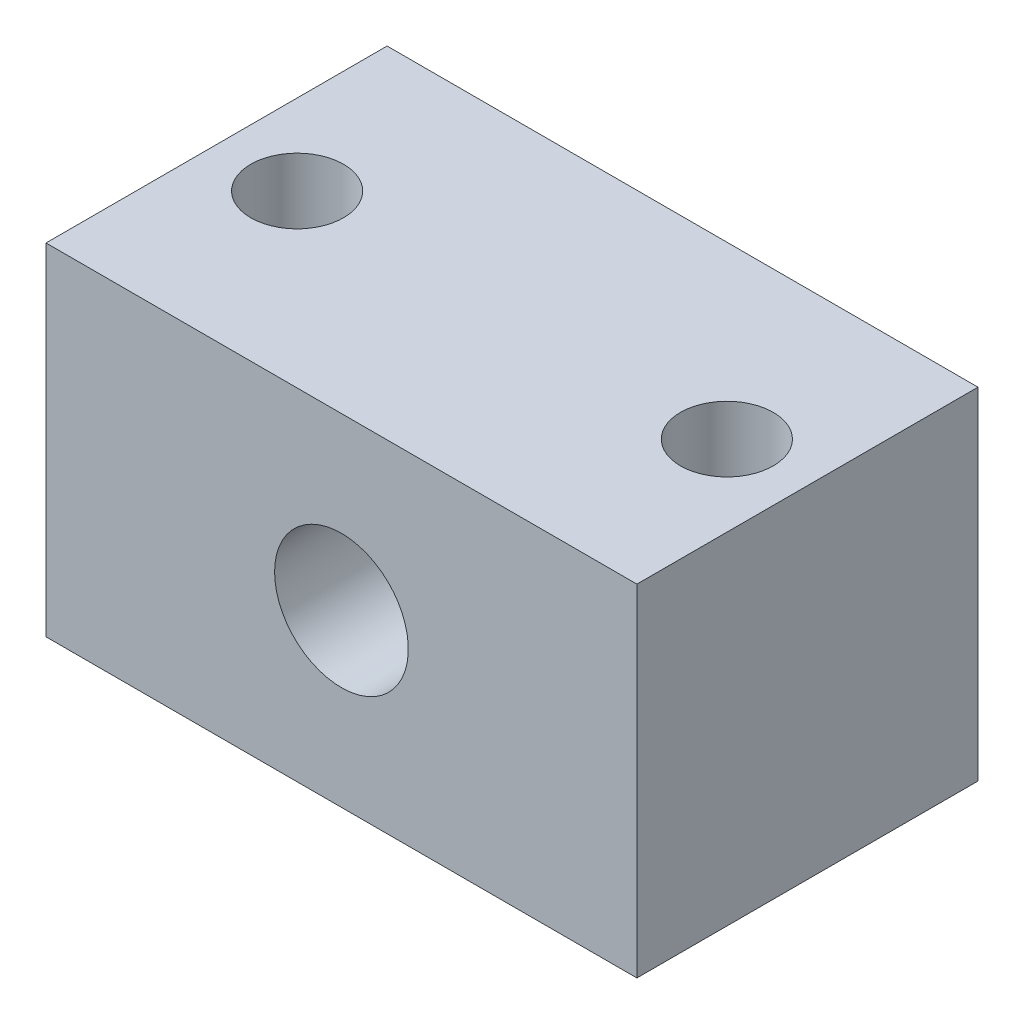
from build123d import *

# Parameters (mm, degrees)
SKETCH1_W             = 22.000000096
SKETCH1_H             = 12.7
BOSS_EXTRUDE1_DEPTH   = 6.35
F_8_32_TAPPED_HOLE1_D = 3.4544
SKETCH4_R             = 2.4892
CUT_EXTRUDE1_DEPTH    = 27.184203334


with BuildPart() as part:
    # Sketch1 → Boss-Extrude1 (new, symmetric)
    with BuildSketch(Plane(origin=(0, 0, 0), x_dir=(1, 0, 0), z_dir=(0, 1, 0))):
        with Locations((11.000000048, 6.35)):
            Rectangle(SKETCH1_W, SKETCH1_H)
    extrude(amount=BOSS_EXTRUDE1_DEPTH, both=True)

    # #8-32 Tapped Hole1 (through all)
    with Locations(Plane(origin=(3.000000096, 6.35, -6.35), x_dir=(0, 0, 1), z_dir=(0, 1, 0))):
        with Locations((0, 0), (0, 16)):
            Hole(F_8_32_TAPPED_HOLE1_D / 2)

    # Sketch4 → Cut-Extrude1 (cut, through all)
    with BuildSketch(Plane(origin=(0, 0, -12.7), x_dir=(-1, 0, 0), z_dir=(0, 0, -1))):
        with Locations((-11.000000048, 0)):
            Circle(SKETCH4_R)
    extrude(amount=-CUT_EXTRUDE1_DEPTH, mode=Mode.SUBTRACT)


solid = part.part
